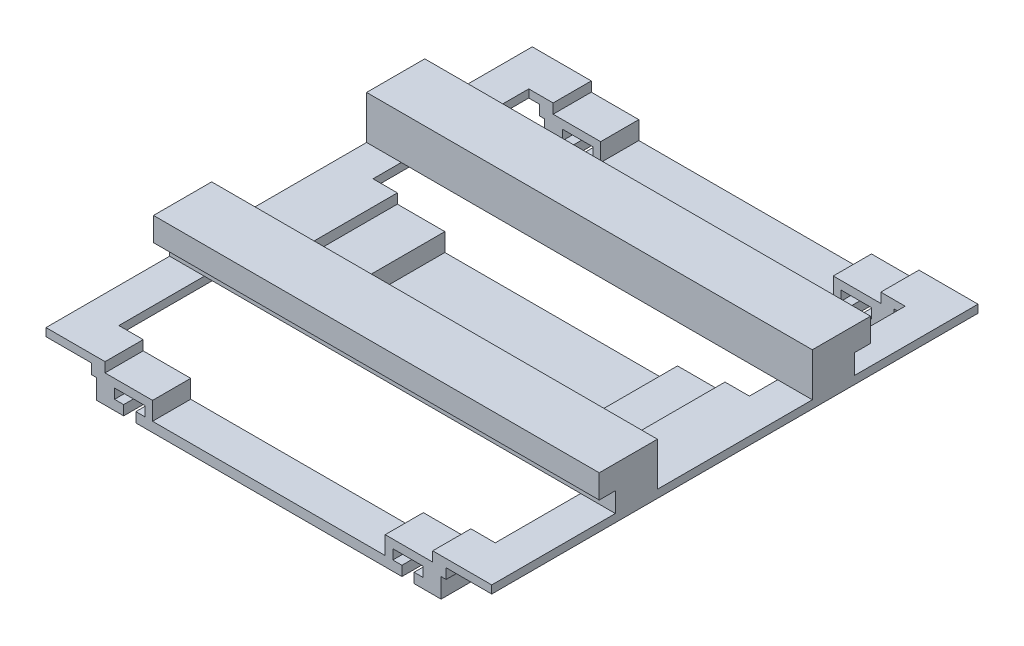
from build123d import *

# Parameters (mm, degrees)
EXTRUDE1_DEPTH = 1219.2
SKETCH2_W      = 943.681413061
SKETCH2_H      = 390.553297683
EXTRUDE2_DEPTH = 1365.086621936
EXTRUDE3_REACH = 2095.85


with BuildPart() as part:
    # Sketch1 → Extrude1 (new body)
    with BuildSketch(Plane(origin=(0, 0, 0), x_dir=(-1, 0, 0), z_dir=(0, 0, 1))):
        Polygon((-604.441999719, -1264.128861053), (-490.141999719, -1264.128861053), (-490.141999719, -1238.728861053), (-477.441999719, -1238.728861053), (-477.441999719, -1189.511943694), (-409.740815056, -1189.511943694), (-409.740815056, -1214.120402374), (-432.600815056, -1214.120402374), (-432.600815056, -1238.728861053), (-356.400815056, -1238.728861053), (-356.400815056, -1214.120402374), (-379.260815056, -1214.120402374), (-379.260815056, -1189.511943694), (287.976815619, -1189.511943694), (287.976815619, -1214.120402374), (265.116815619, -1214.120402374), (265.116815619, -1238.728861053), (341.316815619, -1238.728861053), (341.316815619, -1214.120402374), (318.456815619, -1214.120402374), (318.456815619, -1189.511943694), (386.158000281, -1189.511943694), (386.158000281, -1238.728861053), (398.858000281, -1238.728861053), (398.858000281, -1264.128861053), (513.158000281, -1264.128861053), (513.158000281, -1284.029355434), (365.129820759, -1284.029355434), (365.129820759, -1259.541912826), (246.001721585, -1259.541912826), (246.001721585, -1214.120402374), (-337.285721023, -1214.120402374), (-337.285721023, -1259.541912826), (-456.413820196, -1259.541912826), (-456.413820196, -1284.029355434), (-604.441999719, -1284.029355434), align=None)
    extrude(amount=EXTRUDE1_DEPTH)

    # Sketch2 → Extrude2 (cut, through all)
    with BuildSketch(Plane(origin=(0, 1284.029355434, 0), x_dir=(1, 0, 0), z_dir=(0, 1, 0))):
        with Locations((45.641999718, -290.990730837)):
            Rectangle(SKETCH2_W, SKETCH2_H)
        with Locations((45.641999718, -928.209269163)):
            Rectangle(SKETCH2_W, SKETCH2_H)
    extrude(amount=-EXTRUDE2_DEPTH, mode=Mode.SUBTRACT)

    # Extrude3: up to this face of the body (flat: up to its plane)
    extrude3_end = Plane(part.part.faces().sort_by_distance((604.441999719, 1274.079108244, 609.6))[0])
    # Sketch3 → Extrude3 (add, up to the picked face)
    with BuildSketch(Plane.ZY.offset(513.158000281), mode=Mode.PRIVATE) as extrude3_sk1:
        Polygon((309.974780867, 1284.029355434), (309.974780867, 1333.517105863), (269.543425995, 1333.517105863), (269.543425995, 1392.72016121), (415.385098923, 1392.72016121), (415.385098923, 1284.029355434), align=None)
    extrude3_tool1 = split(extrude(extrude3_sk1.sketch, amount=-EXTRUDE3_REACH, mode=Mode.PRIVATE), bisect_by=extrude3_end, keep=Keep.BOTH, mode=Mode.PRIVATE)
    # Sketch3 → Extrude3 (add, up to the picked face)
    with BuildSketch(Plane.ZY.offset(513.158000281), mode=Mode.PRIVATE) as extrude3_sk2:
        Polygon((803.814901077, 1284.029355434), (909.225219133, 1284.029355434), (909.225219133, 1333.517105863), (949.656574005, 1333.517105863), (949.656574005, 1392.72016121), (803.814901077, 1392.72016121), align=None)
    extrude3_tool2 = split(extrude(extrude3_sk2.sketch, amount=-EXTRUDE3_REACH, mode=Mode.PRIVATE), bisect_by=extrude3_end, keep=Keep.BOTH, mode=Mode.PRIVATE)
    add(extrude3_tool1.solids().sort_by(Axis((-513.158, 1342.650934, 350.077941), (1, 0, 0)))[0])
    add(extrude3_tool2.solids().sort_by(Axis((-513.158, 1342.650934, 869.122059), (1, 0, 0)))[0])


solid = part.part
